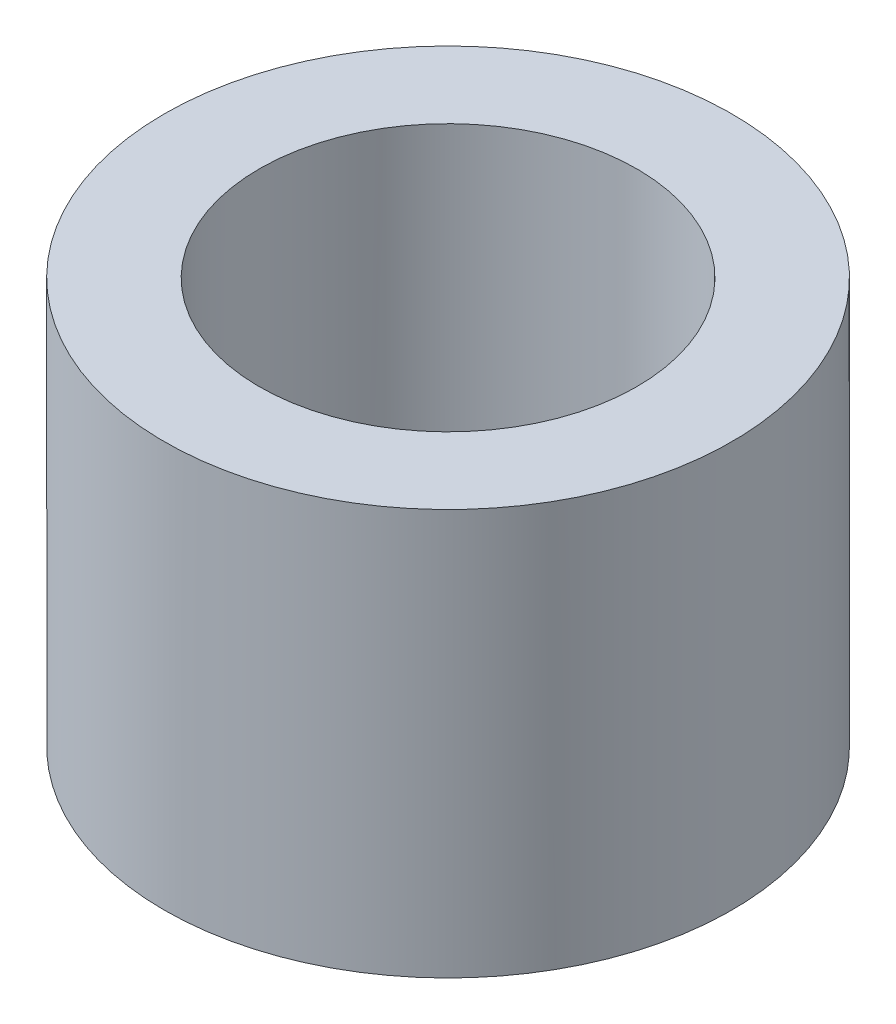
from build123d import *

# Parameters (mm, degrees)
SKETCH1_R           = 2.3875
SKETCH1_R_2         = 1.5875
BOSS_EXTRUDE1_DEPTH = 3.4125


with BuildPart() as part:
    # Sketch1 → Boss-Extrude1 (new body)
    with BuildSketch(Plane(origin=(0, 0, 0), x_dir=(1, 0, 0), z_dir=(0, 1, 0))):
        with Locations(Location((0, 0, 0), (0, 0, 180))):
            Circle(SKETCH1_R)
        with Locations(Location((0, 0, 0), (0, 0, 89.24194014))):
            Circle(SKETCH1_R_2, mode=Mode.SUBTRACT)
    extrude(amount=BOSS_EXTRUDE1_DEPTH)


solid = part.part
